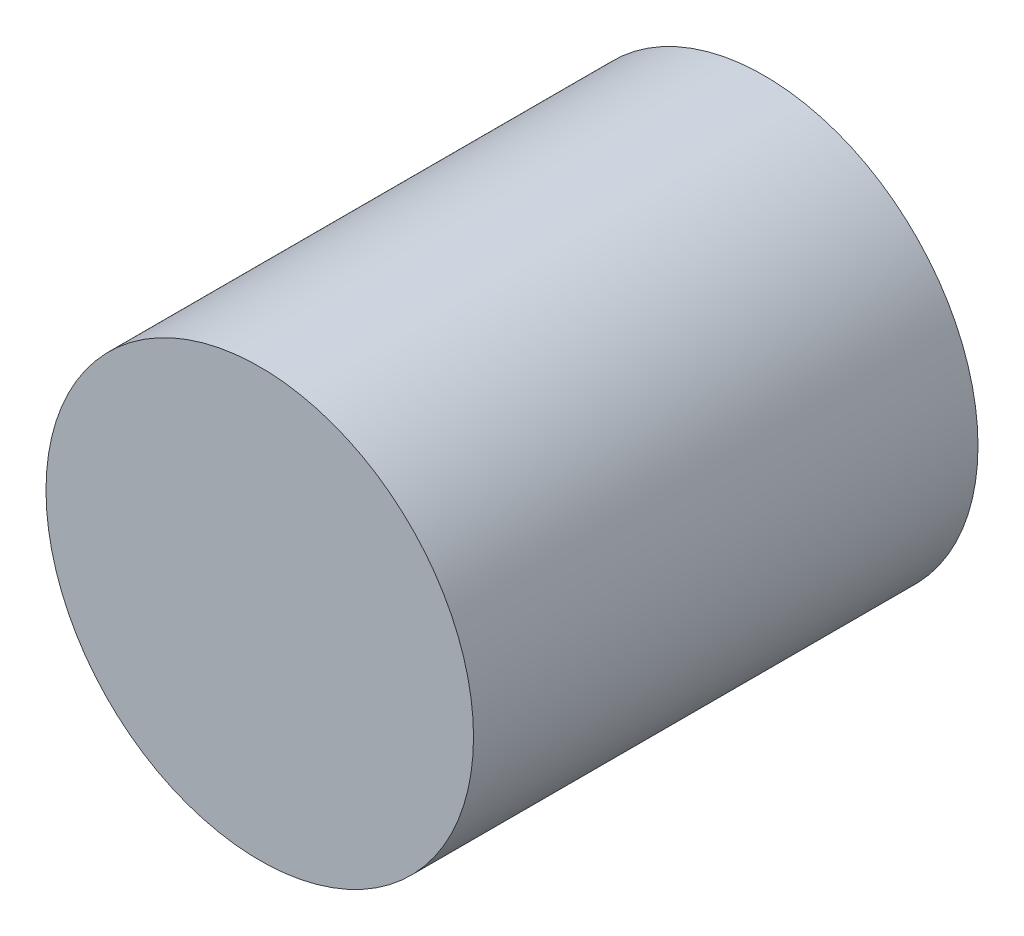
from build123d import *

# Parameters (mm, degrees)
SKETCH1_R           = 25
BOSS_EXTRUDE1_DEPTH = 59


with BuildPart() as part:
    # Sketch1 → Boss-Extrude1 (new body)
    with BuildSketch(Plane.XY):
        Circle(SKETCH1_R)
    extrude(amount=BOSS_EXTRUDE1_DEPTH)


solid = part.part
